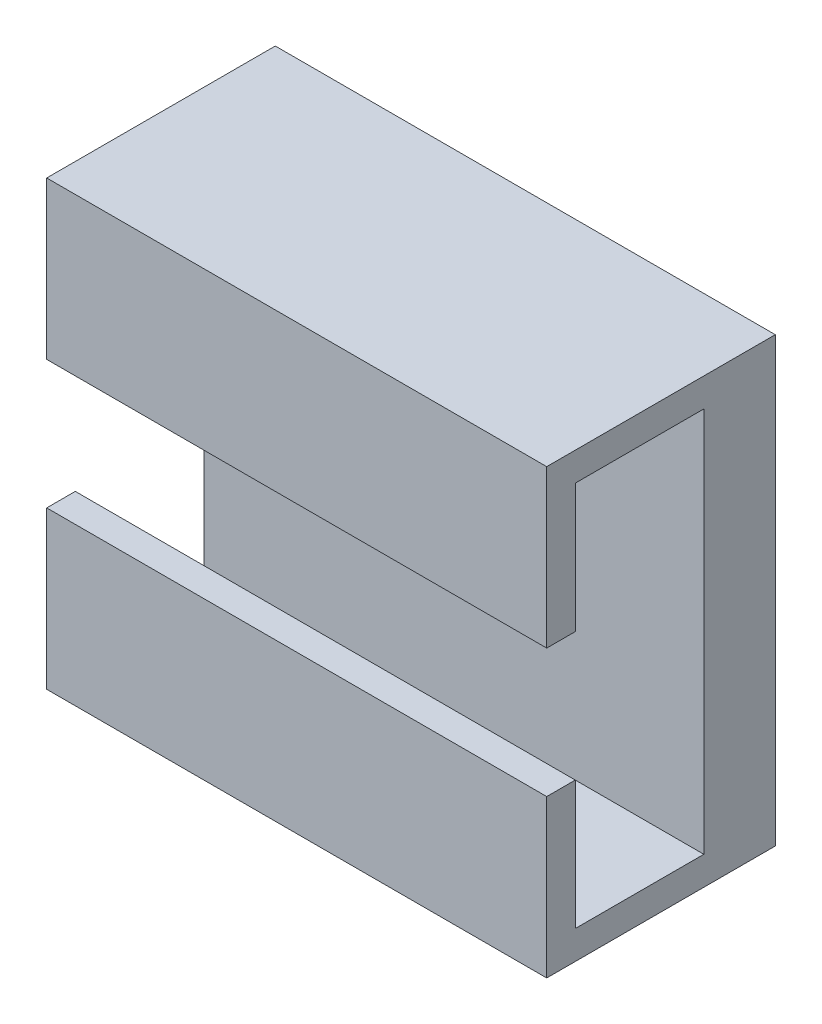
from build123d import *

# Parameters (mm, degrees)
ESQUISSE1_W             = 35
ESQUISSE1_H             = 31
BOSS_EXTRU_1_DEPTH      = 16
ENL_V_MAT_EXTRU_1_DEPTH = 35
ESQUISSE3_R             = 1.75
ENL_V_MAT_EXTRU_2_DEPTH = 5
ESQUISSE4_R             = 2.75
ENL_V_MAT_EXTRU_3_DEPTH = 3


with BuildPart() as part:
    # Esquisse1 → Boss.-Extru.1 (new body)
    with BuildSketch(Plane.XY):
        Rectangle(ESQUISSE1_W, ESQUISSE1_H)
    extrude(amount=BOSS_EXTRU_1_DEPTH)

    # Esquisse2 → Enlèv. mat.-Extru.1 (cut)
    with BuildSketch(Plane.ZY.offset(17.5)):
        Polygon((5, 13.5), (5, -13.5), (14, -13.5), (14, -4.5), (16, -4.5), (16, 4.5), (14, 4.5), (14, 13.5), align=None)
    extrude(amount=-ENL_V_MAT_EXTRU_1_DEPTH, mode=Mode.SUBTRACT)

    # Esquisse3 → Enlèv. mat.-Extru.2 (cut)
    with BuildSketch(Plane.XY.offset(5)):
        Circle(ESQUISSE3_R)
    extrude(amount=-ENL_V_MAT_EXTRU_2_DEPTH, mode=Mode.SUBTRACT)

    # Esquisse4 → Enlèv. mat.-Extru.3 (cut)
    with BuildSketch(Plane.XY.offset(5)):
        Circle(ESQUISSE4_R)
    extrude(amount=-ENL_V_MAT_EXTRU_3_DEPTH, mode=Mode.SUBTRACT)


solid = part.part
